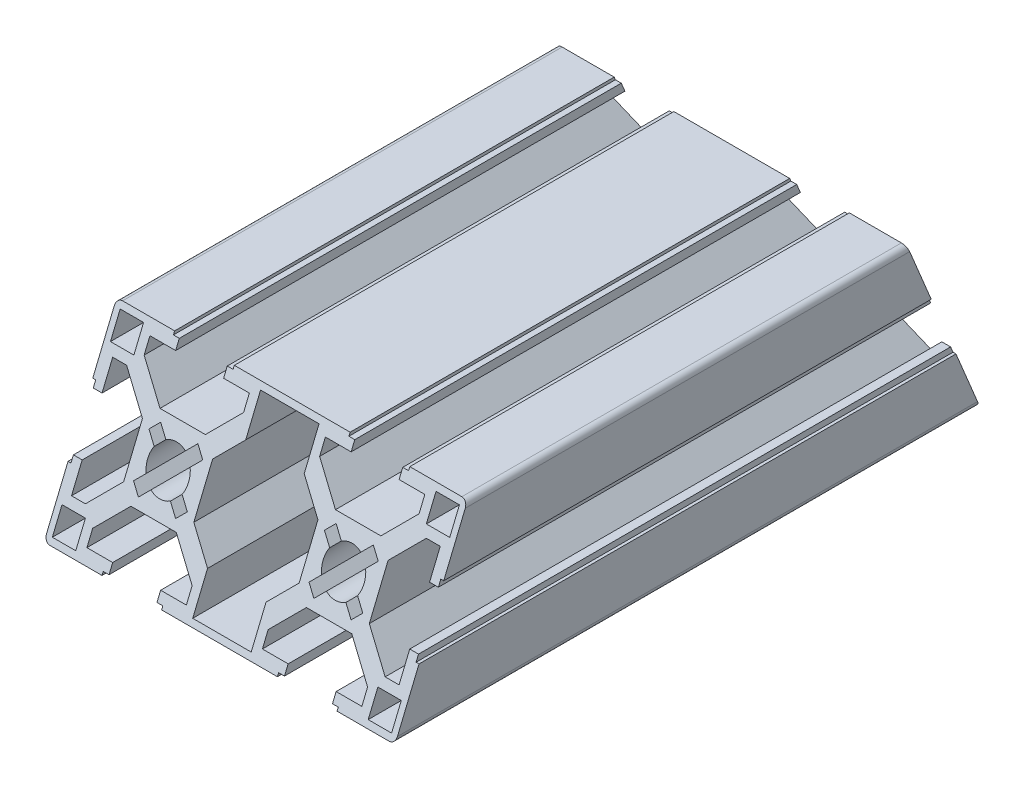
from build123d import *

# Parameters (mm, degrees)
ESBO_O1_W                      = 4
ESBO_O1_H                      = 4
RESSALTO_EXTRUS_O1_DEPTH       = 100
PADR_OCIRCULAR1_COUNT          = 4
PADR_O_LINEAR1_COUNT           = 2
PADR_O_LINEAR1_PITCH           = 30
PADR_O_LINEAR1_COPY_1_SKETCH_W = 4
PADR_O_LINEAR1_COPY_1_SKETCH_H = 4
PADR_O_LINEAR1_COPY_1_DEPTH    = 100
PADR_O_LINEAR1_COPY_2_SKETCH_W = 4
PADR_O_LINEAR1_COPY_2_SKETCH_H = 4
PADR_O_LINEAR1_COPY_2_DEPTH    = 100
PADR_O_LINEAR1_COPY_3_SKETCH_W = 4
PADR_O_LINEAR1_COPY_3_SKETCH_H = 4
PADR_O_LINEAR1_COPY_3_DEPTH    = 100
ESBO_O4_W                      = 10
ESBO_O4_H                      = 28
CORTE_EXTRUS_O1_DEPTH          = 111.679718106
FILETE1_R                      = 1
CUT_EXTRUDE1_DEPTH             = 118.579760163


with BuildPart() as part:
    # Esboço1 → Ressalto-extrusão1 (new body)
    with BuildSketch(Plane.XY):
        with BuildLine():
            ThreePointArc((-1.664601464, 3.078815026), (-0.858529967, 3.393070335), (0, 3.5))
            Line((0, 3.5), (0, 6))
            Line((0, 6), (-3.878679656, 6))
            Line((-3.878679656, 6), (-8.5, 10.621320344))
            Line((-8.5, 10.621320344), (-8.5, 13))
            Line((-8.5, 13), (-4.1, 13))
            Line((-4.1, 13), (-4.1, 14.5))
            Line((-4.1, 14.5), (-5.1, 14.5))
            Line((-5.1, 14.5), (-5.1, 15))
            Line((-5.1, 15), (-15, 15))
            Line((-15, 15), (-15, 5.1))
            Line((-15, 5.1), (-14.5, 5.1))
            Line((-14.5, 5.1), (-14.5, 4.1))
            Line((-14.5, 4.1), (-13, 4.1))
            Line((-13, 4.1), (-13, 8.5))
            Line((-13, 8.5), (-10.621320344, 8.5))
            Line((-10.621320344, 8.5), (-6, 3.878679656))
            Line((-6, 3.878679656), (-6, 0))
            Line((-6, 0), (-3.5, 0))
            ThreePointArc((-3.5, 0), (-3.393070335, 0.858529967), (-3.078815026, 1.664601464))
            Line((-3.078815026, 1.664601464), (-4.596194078, 3.181980515))
            Line((-4.596194078, 3.181980515), (-3.181980515, 4.596194078))
            Line((-3.181980515, 4.596194078), (-1.664601464, 3.078815026))
        make_face()
        with Locations((-12, 12)):
            Rectangle(ESBO_O1_W, ESBO_O1_H, mode=Mode.SUBTRACT)
    ressalto_extrus_o1 = extrude(amount=RESSALTO_EXTRUS_O1_DEPTH)

    # PadrãoCircular1: Ressalto-extrusão1 ×4 about axis
    padr_ocircular1_axis = Axis((0, 0, 0), (0, 0, 1))
    for i in range(1, PADR_OCIRCULAR1_COUNT):
        add(ressalto_extrus_o1.rotate(padr_ocircular1_axis, i * 360 / PADR_OCIRCULAR1_COUNT))

    # Padrão linear1: Ressalto-extrusão1 ×2
    with Locations(*[(i * PADR_O_LINEAR1_PITCH, 0, 0) for i in range(1, PADR_O_LINEAR1_COUNT)]):
        add(ressalto_extrus_o1)

    # Padrão linear1 copy 1 sketch → Padrão linear1 copy 1 (add)
    with BuildSketch(Plane(origin=(30, 0, 0), x_dir=(0, 1, 0), z_dir=(0, 0, 1))):
        with BuildLine():
            ThreePointArc((-1.664601464, 3.078815026), (-0.858529967, 3.393070335), (0, 3.5))
            Line((0, 3.5), (0, 6))
            Line((0, 6), (-3.878679656, 6))
            Line((-3.878679656, 6), (-8.5, 10.621320344))
            Line((-8.5, 10.621320344), (-8.5, 13))
            Line((-8.5, 13), (-4.1, 13))
            Line((-4.1, 13), (-4.1, 14.5))
            Line((-4.1, 14.5), (-5.1, 14.5))
            Line((-5.1, 14.5), (-5.1, 15))
            Line((-5.1, 15), (-15, 15))
            Line((-15, 15), (-15, 5.1))
            Line((-15, 5.1), (-14.5, 5.1))
            Line((-14.5, 5.1), (-14.5, 4.1))
            Line((-14.5, 4.1), (-13, 4.1))
            Line((-13, 4.1), (-13, 8.5))
            Line((-13, 8.5), (-10.621320344, 8.5))
            Line((-10.621320344, 8.5), (-6, 3.878679656))
            Line((-6, 3.878679656), (-6, 0))
            Line((-6, 0), (-3.5, 0))
            ThreePointArc((-3.5, 0), (-3.393070335, 0.858529967), (-3.078815026, 1.664601464))
            Line((-3.078815026, 1.664601464), (-4.596194078, 3.181980515))
            Line((-4.596194078, 3.181980515), (-3.181980515, 4.596194078))
            Line((-3.181980515, 4.596194078), (-1.664601464, 3.078815026))
        make_face()
        with Locations((-12, 12)):
            Rectangle(PADR_O_LINEAR1_COPY_1_SKETCH_W, PADR_O_LINEAR1_COPY_1_SKETCH_H, mode=Mode.SUBTRACT)
    extrude(amount=PADR_O_LINEAR1_COPY_1_DEPTH)

    # Padrão linear1 copy 2 sketch → Padrão linear1 copy 2 (add)
    with BuildSketch(Plane(origin=(30, 0, 0), x_dir=(-1, 0, 0), z_dir=(0, 0, 1))):
        with BuildLine():
            ThreePointArc((-1.664601464, 3.078815026), (-0.858529967, 3.393070335), (0, 3.5))
            Line((0, 3.5), (0, 6))
            Line((0, 6), (-3.878679656, 6))
            Line((-3.878679656, 6), (-8.5, 10.621320344))
            Line((-8.5, 10.621320344), (-8.5, 13))
            Line((-8.5, 13), (-4.1, 13))
            Line((-4.1, 13), (-4.1, 14.5))
            Line((-4.1, 14.5), (-5.1, 14.5))
            Line((-5.1, 14.5), (-5.1, 15))
            Line((-5.1, 15), (-15, 15))
            Line((-15, 15), (-15, 5.1))
            Line((-15, 5.1), (-14.5, 5.1))
            Line((-14.5, 5.1), (-14.5, 4.1))
            Line((-14.5, 4.1), (-13, 4.1))
            Line((-13, 4.1), (-13, 8.5))
            Line((-13, 8.5), (-10.621320344, 8.5))
            Line((-10.621320344, 8.5), (-6, 3.878679656))
            Line((-6, 3.878679656), (-6, 0))
            Line((-6, 0), (-3.5, 0))
            ThreePointArc((-3.5, 0), (-3.393070335, 0.858529967), (-3.078815026, 1.664601464))
            Line((-3.078815026, 1.664601464), (-4.596194078, 3.181980515))
            Line((-4.596194078, 3.181980515), (-3.181980515, 4.596194078))
            Line((-3.181980515, 4.596194078), (-1.664601464, 3.078815026))
        make_face()
        with Locations((-12, 12)):
            Rectangle(PADR_O_LINEAR1_COPY_2_SKETCH_W, PADR_O_LINEAR1_COPY_2_SKETCH_H, mode=Mode.SUBTRACT)
    extrude(amount=PADR_O_LINEAR1_COPY_2_DEPTH)

    # Padrão linear1 copy 3 sketch → Padrão linear1 copy 3 (add)
    with BuildSketch(Plane(origin=(30, 0, 0), x_dir=(0, -1, 0), z_dir=(0, 0, 1))):
        with BuildLine():
            ThreePointArc((-1.664601464, 3.078815026), (-0.858529967, 3.393070335), (0, 3.5))
            Line((0, 3.5), (0, 6))
            Line((0, 6), (-3.878679656, 6))
            Line((-3.878679656, 6), (-8.5, 10.621320344))
            Line((-8.5, 10.621320344), (-8.5, 13))
            Line((-8.5, 13), (-4.1, 13))
            Line((-4.1, 13), (-4.1, 14.5))
            Line((-4.1, 14.5), (-5.1, 14.5))
            Line((-5.1, 14.5), (-5.1, 15))
            Line((-5.1, 15), (-15, 15))
            Line((-15, 15), (-15, 5.1))
            Line((-15, 5.1), (-14.5, 5.1))
            Line((-14.5, 5.1), (-14.5, 4.1))
            Line((-14.5, 4.1), (-13, 4.1))
            Line((-13, 4.1), (-13, 8.5))
            Line((-13, 8.5), (-10.621320344, 8.5))
            Line((-10.621320344, 8.5), (-6, 3.878679656))
            Line((-6, 3.878679656), (-6, 0))
            Line((-6, 0), (-3.5, 0))
            ThreePointArc((-3.5, 0), (-3.393070335, 0.858529967), (-3.078815026, 1.664601464))
            Line((-3.078815026, 1.664601464), (-4.596194078, 3.181980515))
            Line((-4.596194078, 3.181980515), (-3.181980515, 4.596194078))
            Line((-3.181980515, 4.596194078), (-1.664601464, 3.078815026))
        make_face()
        with Locations((-12, 12)):
            Rectangle(PADR_O_LINEAR1_COPY_3_SKETCH_W, PADR_O_LINEAR1_COPY_3_SKETCH_H, mode=Mode.SUBTRACT)
    extrude(amount=PADR_O_LINEAR1_COPY_3_DEPTH)

    # Esboço4 → Corte-extrusão1 (cut, through all)
    with BuildSketch(Plane(origin=(0, 0, 0), x_dir=(-1, 0, 0), z_dir=(0, 0, -1))):
        with Locations((-15, 0)):
            Rectangle(ESBO_O4_W, ESBO_O4_H)
    extrude(amount=-CORTE_EXTRUS_O1_DEPTH, mode=Mode.SUBTRACT)

    # Filete1
    filete1_edges = [part.edges().sort_by_distance(p)[0] for p in [
        (45, -15, 50),
        (45, 15, 50),
        (-15, 15, 50),
        (-15, -15, 50),
    ]]
    fillet(filete1_edges, radius=FILETE1_R)

    # Sketch1 → Cut-Extrude1 (cut, through all)
    with BuildSketch(Plane.ZY.offset(15)):
        Polygon((0, -15), (12.426406871, 15), (0, 15), align=None)
        Polygon((100, -15), (87.573593129, 15), (100, 15), align=None)
    extrude(amount=-CUT_EXTRUDE1_DEPTH, mode=Mode.SUBTRACT)


solid = part.part
